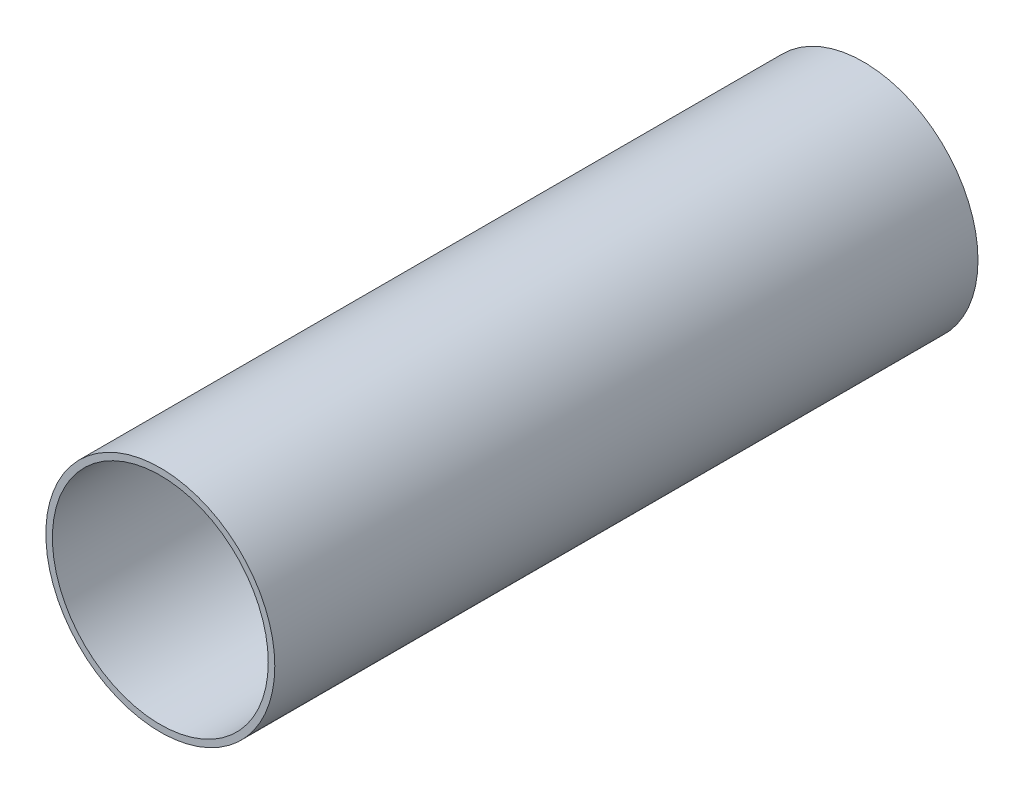
from build123d import *

# Parameters (mm, degrees)
SKETCH_1_R      = 35
SKETCH_1_R_2    = 33
EXTRUDE_1_DEPTH = 215


with BuildPart() as part:
    # 草图1 → 凸台-拉伸1 (new body)
    with BuildSketch(Plane.XY):
        Circle(SKETCH_1_R)
        Circle(SKETCH_1_R_2, mode=Mode.SUBTRACT)
    extrude(amount=EXTRUDE_1_DEPTH)


solid = part.part
